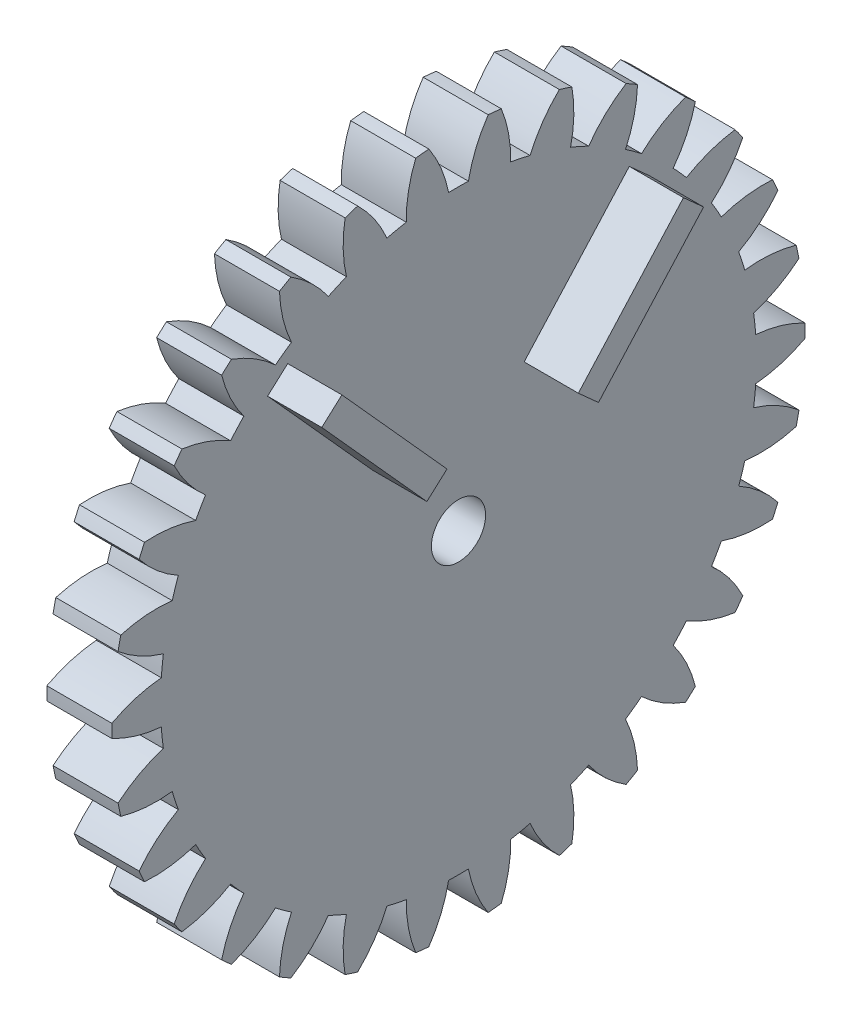
from build123d import *

# Parameters (mm, degrees)
BASPROSKE_W             = 12
BASPROSKE_H             = 64
TOOTHCUT_DEPTH          = 92.301697684
TEETHCUTS_COUNT         = 30
TEETHCUTS_ANGLE         = 348
HUBNEAONESKE_R          = 15
HUBNEARONE_DEPTH        = 28.0000508
BORSKE_R                = 5
BORE_DEPTH              = 40.0000508
BOSS_EXTRUDE1_DEPTH     = 10
CUT_EXTRUDE1_DEPTH      = 95.583269576
CUT_EXTRUDE1_DEPTH_BACK = 95.583269576
SKETCH2_R               = 1.5


with BuildPart() as part:
    # BasProSke → Base-Revolve (revolve)
    with BuildSketch(Plane(origin=(0, 0, 0), x_dir=(1, 0, 0), z_dir=(0, 1, 0)), mode=Mode.PRIVATE) as base_revolve_sk:
        with Locations((6, 32)):
            Rectangle(BASPROSKE_W, BASPROSKE_H)
    revolve(base_revolve_sk.sketch.rotate(Axis((-10, 0, 0), (1, 0, 0)), 180), axis=Axis((-10, 0, 0), (1, 0, 0)))

    # TooCutSke → ToothCut (cut, through all)
    with BuildSketch(Plane(origin=(0, 0, 0), x_dir=(0, 0, -1), z_dir=(1, 0, 0))):
        with BuildLine():
            ThreePointArc((1.826062386, 54.968677419), (0, 54.999), (-1.826062386, 54.968677419))
            ThreePointArc((-1.826062386, 54.968677419), (-3.216844615, 59.563303361), (-5.494219854, 63.789226311))
            ThreePointArc((-5.494219854, 63.789226311), (0, 64.0254), (5.494219854, 63.789226311))
            ThreePointArc((5.494219854, 63.789226311), (3.216844615, 59.563303361), (1.826062386, 54.968677419))
        make_face()
    toothcut = extrude(amount=TOOTHCUT_DEPTH, mode=Mode.SUBTRACT)

    # TeethCuts: ToothCut ×30 about axis
    teethcuts_axis = Axis((-10, 0, 0), (1, 0, 0))
    for i in range(1, TEETHCUTS_COUNT):
        add(toothcut.rotate(teethcuts_axis, i * TEETHCUTS_ANGLE / (TEETHCUTS_COUNT - 1)), mode=Mode.SUBTRACT)

    # HubNeaOneSke → HubNearOne (add)
    with BuildSketch(Plane.ZY):
        with Locations(Location((0, 0, 0), (0, 0, 180))):
            Circle(HUBNEAONESKE_R)
    extrude(amount=HUBNEARONE_DEPTH)

    # BorSke → Bore (cut, symmetric)
    with BuildSketch(Plane(origin=(0, 0, 0), x_dir=(0, 0, -1), z_dir=(1, 0, 0))):
        with Locations(Location((0, 0, 0), (0, 0, 180))):
            Circle(BORSKE_R)
    extrude(amount=BORE_DEPTH, both=True, mode=Mode.SUBTRACT)

    # Sketch1 → Boss-Extrude1 (add)
    with BuildSketch(Plane(origin=(12, 0, 0), x_dir=(0, 0, -1), z_dir=(1, 0, 0))):
        Polygon((-35.241579442, 39.13973917), (-31.525855314, 42.485392202), (-12.12106773, 20.934192263), (-15.836791857, 17.588539232), align=None)
        Polygon((15.836791857, 17.588539232), (35.241579442, 39.13973917), (31.525855314, 42.485392202), (12.12106773, 20.934192263), align=None)
    extrude(amount=BOSS_EXTRUDE1_DEPTH)

    # Sketch2 → Cut-Extrude1 (cut, two sides: drawn at the far end of the back side and taken through both)
    with BuildSketch(Plane.XY.offset(-CUT_EXTRUDE1_DEPTH_BACK)):
        with Locations((-14.0000254, 0)):
            Circle(SKETCH2_R)
    extrude(amount=CUT_EXTRUDE1_DEPTH + CUT_EXTRUDE1_DEPTH_BACK, mode=Mode.SUBTRACT)


solid = part.part
